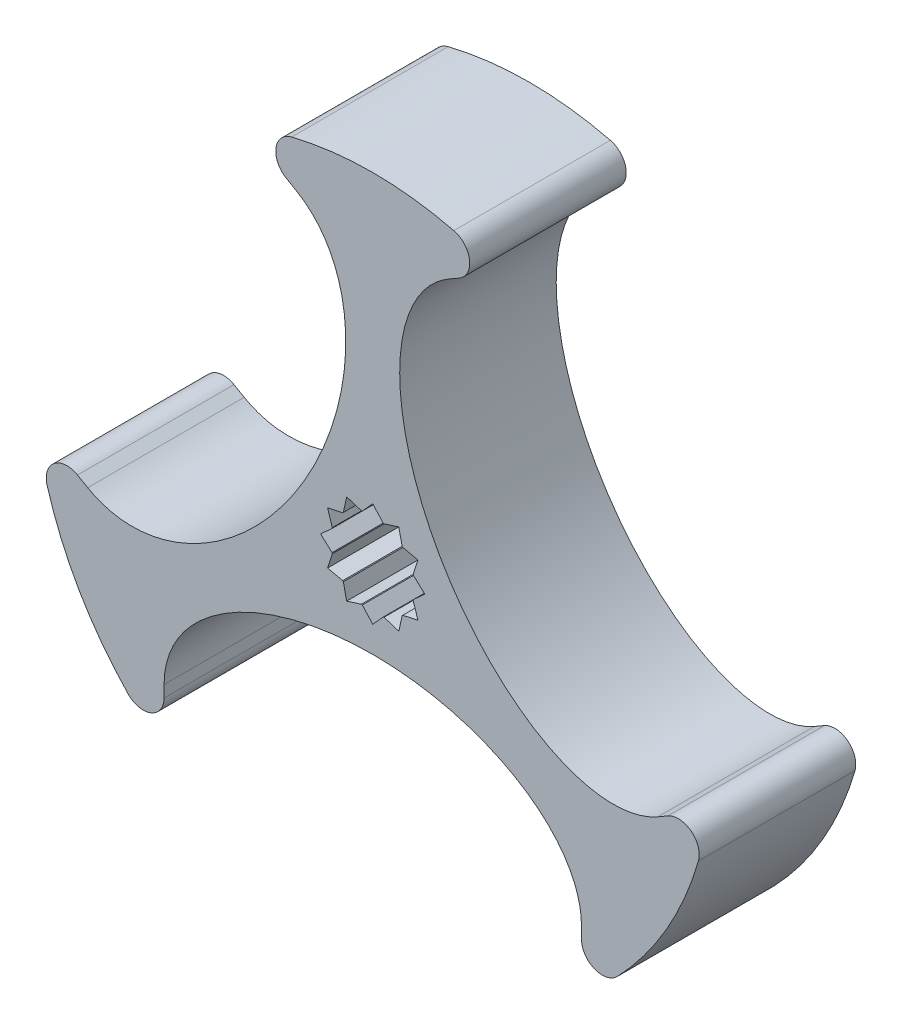
from build123d import *

# Parameters (mm, degrees)
SALIENTE_EXTRUIR2_DEPTH = 15
CROQUIS2_R              = 4.025
CORTAR_EXTRUIR1_DEPTH   = 48.545700558
CORTAR_EXTRUIR2_DEPTH   = 48.545700558


with BuildPart() as part:
    # Croquis1 → Saliente-Extruir2 (new body)
    with BuildSketch(Plane.XY):
        with BuildLine():
            Line((20, -20), (20, -21.124630174))
            ThreePointArc((20, -21.124630174), (21.253423112, -22.980060839), (23.442622951, -22.509851825))
            ThreePointArc((23.442622951, -22.509851825), (28.145825623, -16.25), (31.215414991, -9.046981094))
            ThreePointArc((31.215414991, -9.046981094), (30.528028023, -6.915973913), (28.294466376, -6.758192989))
            Line((28.294466376, -6.758192989), (27.320508076, -7.320508076))
            add(Edge.make_bspline(
                [(7.320508076, 27.320508076), (-3.504809472, 21.070508076), (6.495190528, 3.75), (16.495190528, -13.570508076), (27.320508076, -7.320508076)],
                knots=[3.141592654, 3.141592654, 3.141592654, 4.71238898, 4.71238898, 6.283185307, 6.283185307, 6.283185307], degree=2, weights=[1, 0.707106781, 1, 0.707106781, 1]))
            Line((7.320508076, 27.320508076), (8.294466376, 27.882823163))
            ThreePointArc((8.294466376, 27.882823163), (9.274604911, 29.896034752), (7.772792041, 31.556832919))
            ThreePointArc((7.772792041, 31.556832919), (0, 32.5), (-7.772792041, 31.556832919))
            ThreePointArc((-7.772792041, 31.556832919), (-9.274604911, 29.896034752), (-8.294466376, 27.882823163))
            Line((-8.294466376, 27.882823163), (-7.320508076, 27.320508076))
            add(Edge.make_bspline(
                [(-27.320508076, -7.320508076), (-16.495190528, -13.570508076), (-6.495190528, 3.75), (3.504809472, 21.070508076), (-7.320508076, 27.320508076)],
                knots=[0, 0, 0, 1.570796327, 1.570796327, 3.141592654, 3.141592654, 3.141592654], degree=2, weights=[1, 0.707106781, 1, 0.707106781, 1]))
            Line((-27.320508076, -7.320508076), (-28.294466376, -6.758192989))
            ThreePointArc((-28.294466376, -6.758192989), (-30.528028023, -6.915973913), (-31.215414991, -9.046981094))
            ThreePointArc((-31.215414991, -9.046981094), (-28.145825623, -16.25), (-23.442622951, -22.509851825))
            ThreePointArc((-23.442622951, -22.509851825), (-21.253423112, -22.980060839), (-20, -21.124630174))
            Line((-20, -21.124630174), (-20, -20))
            add(Edge.make_bspline(
                [(20, -20), (20, -7.5), (0, -7.5), (-20, -7.5), (-20, -20)],
                knots=[3.141592654, 3.141592654, 3.141592654, 4.71238898, 4.71238898, 6.283185307, 6.283185307, 6.283185307], degree=2, weights=[1, 0.707106781, 1, 0.707106781, 1]))
        make_face()
    extrude(amount=SALIENTE_EXTRUIR2_DEPTH)

    # Croquis2 → Cortar-Extruir1 (cut, through all)
    with BuildSketch(Plane.XY.offset(15)):
        Circle(CROQUIS2_R)
    extrude(amount=-CORTAR_EXTRUIR1_DEPTH, mode=Mode.SUBTRACT)

    # Croquis3 → Cortar-Extruir2 (cut, through all)
    with BuildSketch(Plane.XY.offset(15)):
        Polygon((-1, 3.898797892), (0, 5), (1, 3.898797892), align=None)
        Polygon((1.083373542, 3.876458018), (2.5, 4.330127019), (2.81542435, 2.876458018), align=None)
        Polygon((2.876458018, 2.81542435), (4.330127019, 2.5), (3.876458018, 1.083373542), align=None)
        Polygon((3.898797892, 1), (5, 0), (3.898797892, -1), align=None)
        Polygon((3.876458018, -1.083373542), (4.330127019, -2.5), (2.876458018, -2.81542435), align=None)
        Polygon((2.81542435, -2.876458018), (2.5, -4.330127019), (1.083373542, -3.876458018), align=None)
        Polygon((1, -3.898797892), (0, -5), (-1, -3.898797892), align=None)
        Polygon((-1.083373542, -3.876458018), (-2.5, -4.330127019), (-2.81542435, -2.876458018), align=None)
        Polygon((-2.876458018, -2.81542435), (-4.330127019, -2.5), (-3.876458018, -1.083373542), align=None)
        Polygon((-3.898797892, -1), (-5, 0), (-3.898797892, 1), align=None)
        Polygon((-3.876458018, 1.083373542), (-4.330127019, 2.5), (-2.876458018, 2.81542435), align=None)
        Polygon((-2.81542435, 2.876458018), (-2.5, 4.330127019), (-1.083373542, 3.876458018), align=None)
    extrude(amount=-CORTAR_EXTRUIR2_DEPTH, mode=Mode.SUBTRACT)


solid = part.part
